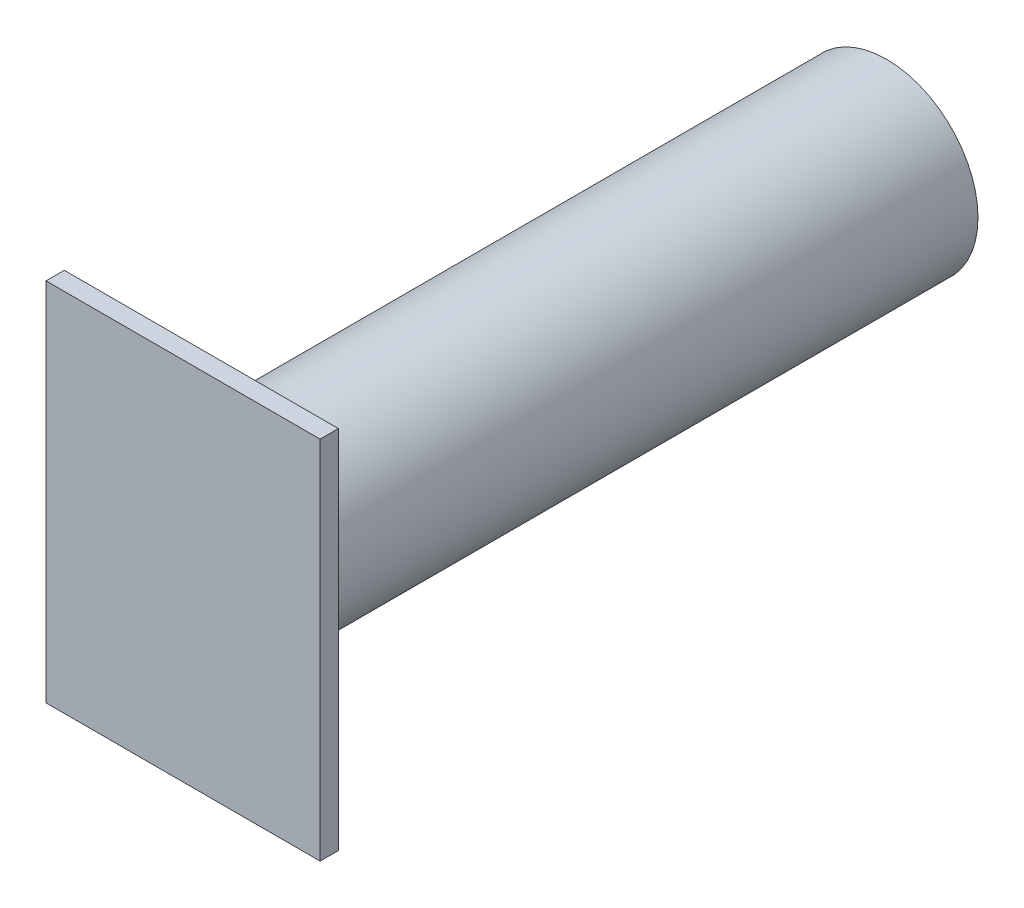
from build123d import *

# Parameters (mm, degrees)
CROQUIS1_R              = 10
SALIENTE_EXTRUIR1_DEPTH = 75
CROQUIS2_W              = 30
CROQUIS2_H              = 40
SALIENTE_EXTRUIR2_DEPTH = 2


with BuildPart() as part:
    # Croquis1 → Saliente-Extruir1 (new body)
    with BuildSketch(Plane.XY):
        Circle(CROQUIS1_R)
    extrude(amount=SALIENTE_EXTRUIR1_DEPTH)

    # Croquis2 → Saliente-Extruir2 (add)
    with BuildSketch(Plane.XY.offset(75)):
        Rectangle(CROQUIS2_W, CROQUIS2_H)
    extrude(amount=SALIENTE_EXTRUIR2_DEPTH)


solid = part.part
